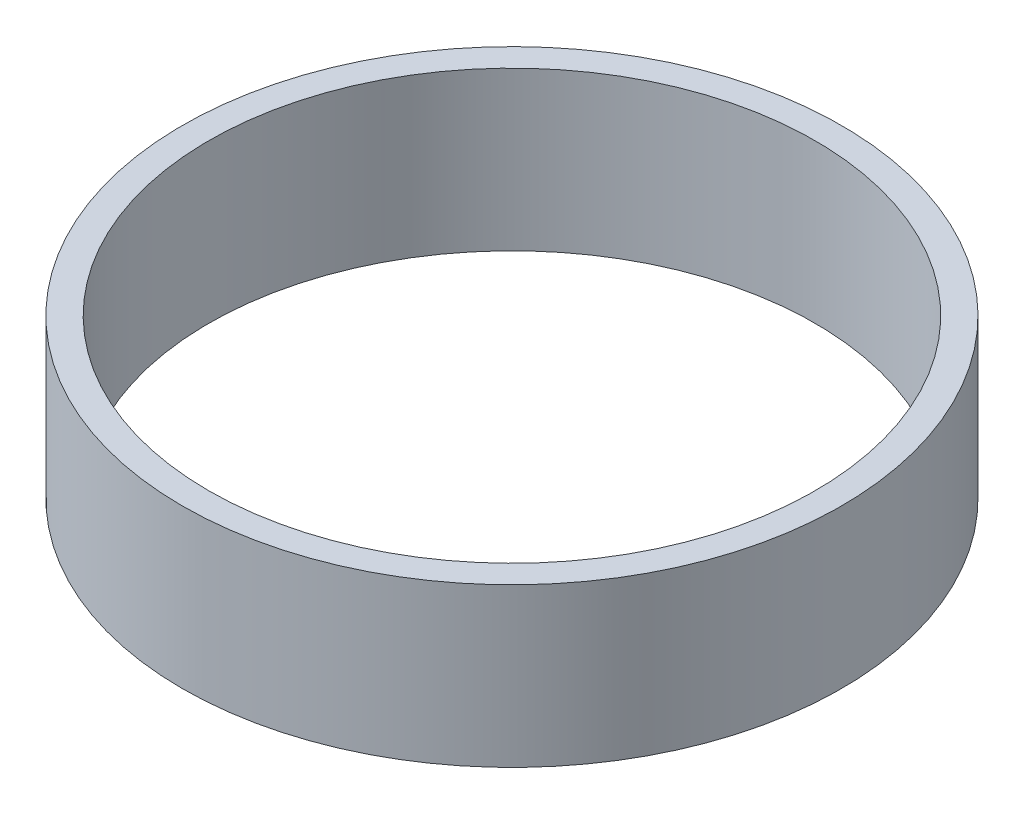
from build123d import *

# Parameters (mm, degrees)
SKETCH1_R           = 6.25
SKETCH1_R_2         = 5.75
BOSS_EXTRUDE1_DEPTH = 3


with BuildPart() as part:
    # Sketch1 → Boss-Extrude1 (new body)
    with BuildSketch(Plane(origin=(0, 0, 0), x_dir=(1, 0, 0), z_dir=(0, 1, 0))):
        with Locations(Location((0, 0, 0), (0, 0, 270))):
            Circle(SKETCH1_R)
        with Locations(Location((0, 0, 0), (0, 0, 270))):
            Circle(SKETCH1_R_2, mode=Mode.SUBTRACT)
    extrude(amount=BOSS_EXTRUDE1_DEPTH)


solid = part.part
